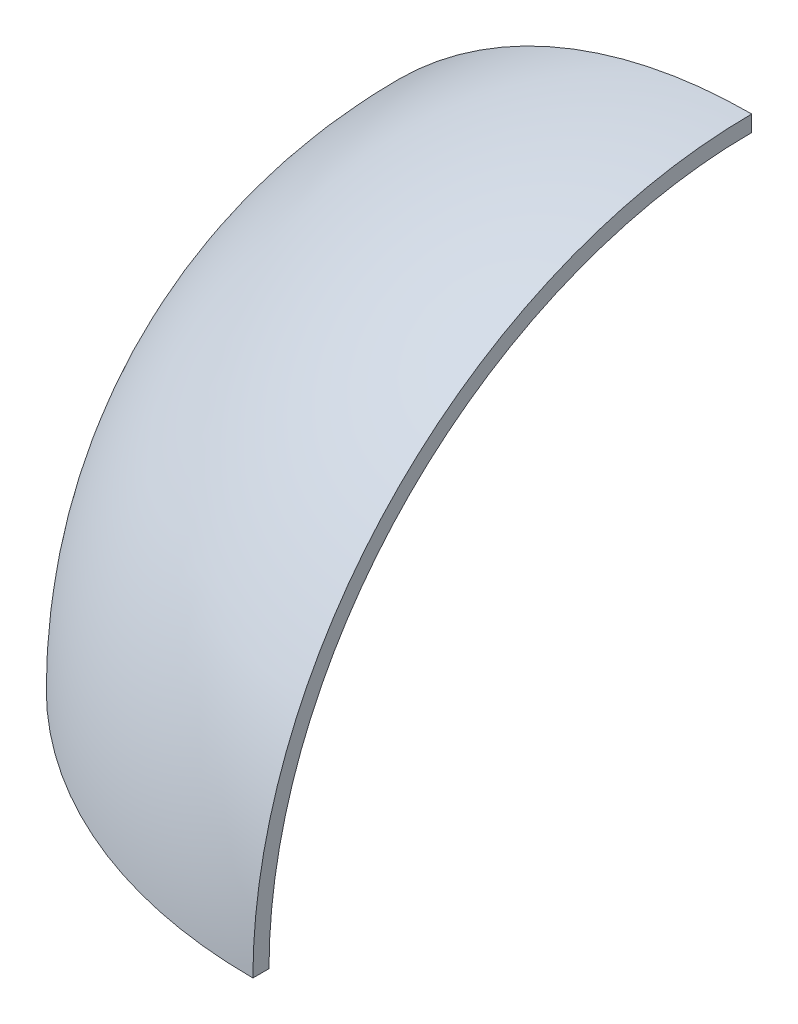
from build123d import *

# Parameters (mm, degrees)
REVOLVE_1_ANGLE = 90


with BuildPart() as part:
    # 草图2 → 旋转1 (revolve)
    with BuildSketch(Plane.XY):
        with BuildLine():
            Line((0, 30), (0, 31))
            ThreePointArc((0, 31), (-21.920310217, 21.920310217), (-31, 0))
            Line((-31, 0), (-30, 0))
            ThreePointArc((-30, 0), (-21.213203436, 21.213203436), (0, 30))
        make_face()
    revolve(axis=Axis((0, 30, 0), (0, 1, 0)), revolution_arc=REVOLVE_1_ANGLE)


solid = part.part
